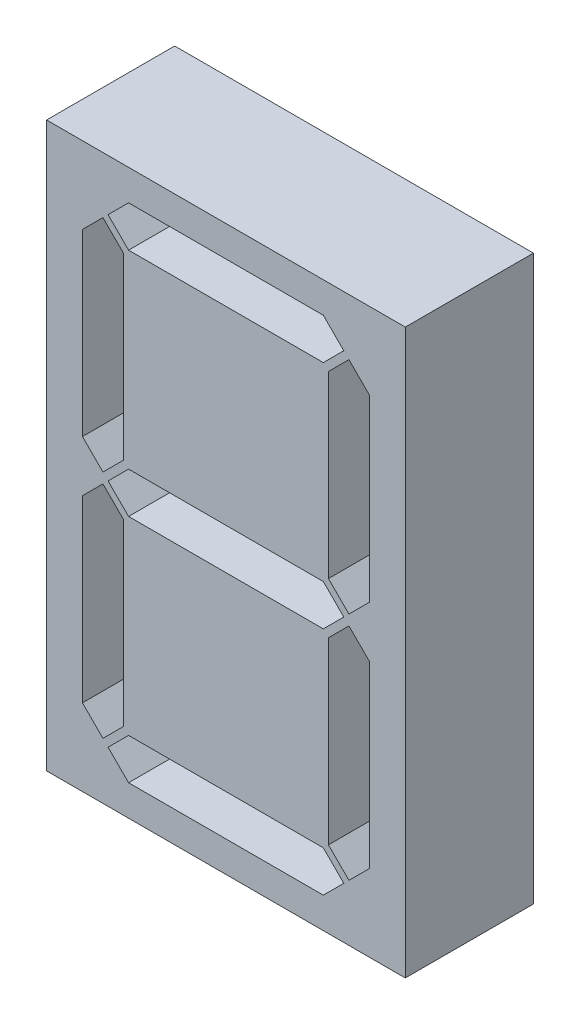
from build123d import *

# Parameters (mm, degrees)
SKETCH1_W           = 70
SKETCH1_H           = 110
BOSS_EXTRUDE1_DEPTH = 25
SKETCH2_W           = 60.4
SKETCH2_H           = 100.4
CUT_EXTRUDE1_DEPTH  = 1.6
FILLET1_R           = 3
CUT_EXTRUDE4_DEPTH  = 133.467203488
CUT_EXTRUDE5_DEPTH  = 133.467203488
CUT_EXTRUDE6_DEPTH  = 1
SKETCH3_R           = 2
CUT_EXTRUDE7_DEPTH  = 3.5
SKETCH8_W           = 34
SKETCH8_H           = 31
BOSS_EXTRUDE2_DEPTH = 1


with BuildPart() as part:
    # Sketch1 → Boss-Extrude1 (new body)
    with BuildSketch(Plane.XY):
        with Locations((35, 55)):
            Rectangle(SKETCH1_W, SKETCH1_H)
    extrude(amount=BOSS_EXTRUDE1_DEPTH)

    # Sketch2 → Cut-Extrude1 (cut)
    with BuildSketch(Plane(origin=(0, 0, 0), x_dir=(-1, 0, 0), z_dir=(0, 0, -1))):
        with Locations((-35, 55)):
            Rectangle(SKETCH2_W, SKETCH2_H)
    extrude(amount=-CUT_EXTRUDE1_DEPTH, mode=Mode.SUBTRACT)

    # Fillet1
    fillet1_edges = [part.edges().sort_by_distance(p)[0] for p in [
        (65.2, 4.8, 0.8),
        (65.2, 105.2, 0.8),
        (4.8, 105.2, 0.8),
        (4.8, 4.8, 0.8),
    ]]
    fillet(fillet1_edges, radius=FILLET1_R)

    # Sketch5 → Cut-Extrude4 (cut, through all)
    with BuildSketch(Plane(origin=(0, 0, 1.6), x_dir=(-1, 0, 0), z_dir=(0, 0, -1))):
        Polygon((-54, 14), (-16, 14), (-12, 10), (-16, 6), (-54, 6), (-58, 10), align=None)
        Polygon((-58, 55), (-54, 59), (-16, 59), (-12, 55), (-16, 51), (-54, 51), align=None)
        Polygon((-58, 100), (-54, 104), (-16, 104), (-12, 100), (-16, 96), (-54, 96), align=None)
    extrude(amount=-CUT_EXTRUDE4_DEPTH, mode=Mode.SUBTRACT)

    # Sketch6 → Cut-Extrude5 (cut, through all)
    with BuildSketch(Plane(origin=(0, 0, 1.6), x_dir=(-1, 0, 0), z_dir=(0, 0, -1))):
        Polygon((-55, 15), (-55, 50), (-59, 54), (-63, 50), (-63, 15), (-59, 11), align=None)
        Polygon((-15, 50), (-11, 54), (-7, 50), (-7, 15), (-11, 11), (-15, 15), align=None)
        Polygon((-63, 95), (-59, 99), (-55, 95), (-55, 60), (-59, 56), (-63, 60), align=None)
        Polygon((-15, 95), (-11, 99), (-7, 95), (-7, 60), (-11, 56), (-15, 60), align=None)
    extrude(amount=-CUT_EXTRUDE5_DEPTH, mode=Mode.SUBTRACT)

    # Sketch7 → Cut-Extrude6 (cut)
    with BuildSketch(Plane(origin=(0, 0, 1.6), x_dir=(-1, 0, 0), z_dir=(0, 0, -1))):
        Polygon((-55, 95), (-54, 96), (-16, 96), (-15, 95), (-15, 60), (-16, 59), (-54, 59), (-55, 60), align=None)
        Polygon((-54, 14), (-55, 15), (-55, 50), (-54, 51), (-16, 51), (-15, 50), (-15, 15), (-16, 14), align=None)
    extrude(amount=-CUT_EXTRUDE6_DEPTH, mode=Mode.SUBTRACT)

    # Sketch3 → Cut-Extrude7 (cut)
    with BuildSketch(Plane(origin=(0, 0, 1.6), x_dir=(-1, 0, 0), z_dir=(0, 0, -1))):
        with Locations((-61.5, 101.5)):
            Circle(SKETCH3_R)
        with Locations((-61.5, 8.5)):
            Circle(SKETCH3_R)
        with Locations((-8.5, 8.5)):
            Circle(SKETCH3_R)
        with Locations((-8.5, 101.5)):
            Circle(SKETCH3_R)
    extrude(amount=-CUT_EXTRUDE7_DEPTH, mode=Mode.SUBTRACT)

    # Sketch8 → Boss-Extrude2 (add)
    with BuildSketch(Plane(origin=(0, 0, 2.6), x_dir=(-1, 0, 0), z_dir=(0, 0, -1))):
        with Locations((-35, 77.5)):
            Rectangle(SKETCH8_W, SKETCH8_H)
        with Locations((-35, 32.5)):
            Rectangle(SKETCH8_W, SKETCH8_H)
    extrude(amount=BOSS_EXTRUDE2_DEPTH)


solid = part.part
